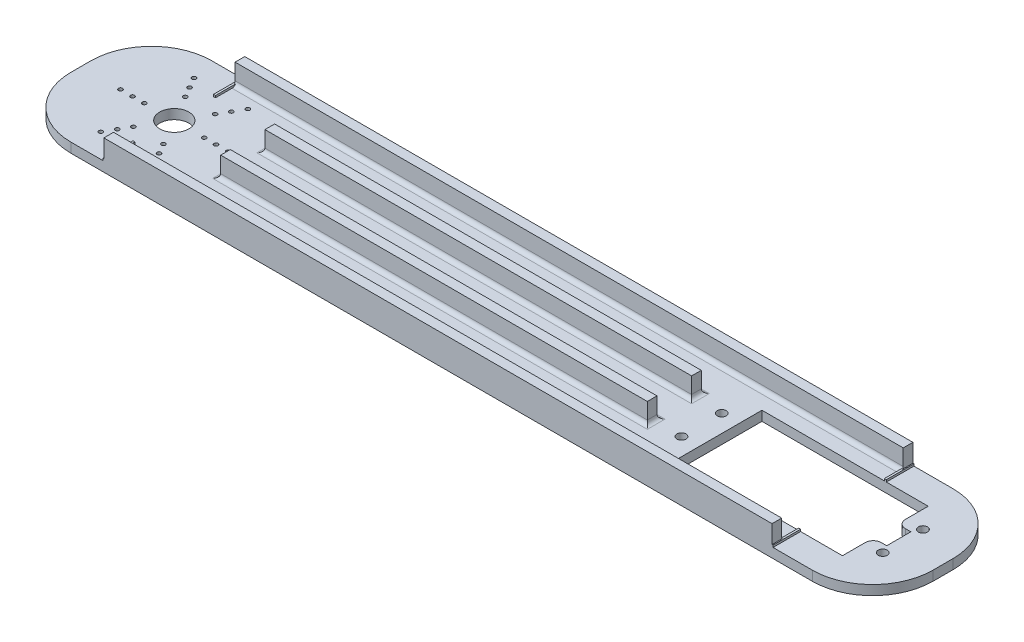
from build123d import *

# Parameters (mm, degrees)
SKETCH1_W               = 214.2
SKETCH1_H               = 35
BOSS_EXTRUDE1_DEPTH     = 2.4
SKETCH2_R               = 1.13
SKETCH2_R_2             = 3.625
SKETCH2_R_3             = 0.5
SKETCH2_W               = 40
SKETCH2_H               = 20
CUT_EXTRUDE1_DEPTH      = 2.4
SKETCH4_W               = 4
SKETCH4_H               = 6
CUT_EXTRUDE2_DEPTH      = 2.4
SKETCH5_W               = 0.5
SKETCH5_H               = 7.5
BOSS_EXTRUDE2_DEPTH     = 0.5
CUT_EXTRUDE3_DEPTH      = 134.373649476
CUT_EXTRUDE3_DEPTH_BACK = 134.373649476
SKETCH7_W               = 41.3
SKETCH7_H               = 21.3
SKETCH7_W_2             = 40
SKETCH7_H_2             = 20
SKETCH8_W               = 166
SKETCH8_H               = 2.4
SKETCH8_W_2             = 106
BOSS_EXTRUDE3_DEPTH     = 5
FILLET1_R               = 15
FILLET2_R               = 2
FILLET3_R               = 1


with BuildPart() as part:
    # Sketch1 → Boss-Extrude1 (new body)
    with BuildSketch(Plane(origin=(0, 0, 0), x_dir=(1, 0, 0), z_dir=(0, 1, 0))):
        with Locations((20.422946176, 21.495750708)):
            Rectangle(SKETCH1_W, SKETCH1_H)
    extrude(amount=BOSS_EXTRUDE1_DEPTH)

    # Sketch2 → Cut-Extrude1 (cut)
    with BuildSketch(Plane(origin=(0, 2.4, 0), x_dir=(1, 0, 0), z_dir=(0, 1, 0))):
        with Locations(Location((67.522946176, 26.495750708, 0), (0, 0, 270))):
            Circle(SKETCH2_R)
        with Locations(Location((117.522946176, 26.495750708, 0), (0, 0, 270))):
            Circle(SKETCH2_R)
        with Locations(Location((117.522946176, 16.495750708, 0), (0, 0, 90))):
            Circle(SKETCH2_R)
        with Locations(Location((67.522946176, 16.495750708, 0), (0, 0, 90))):
            Circle(SKETCH2_R)
        with Locations(Location((-63.477053824, 21.495750708, 0), (0, 0, 270))):
            Circle(SKETCH2_R_2)
        with Locations(Location((-70.907053824, 21.495750708, 0), (0, 0, 270))):
            Circle(SKETCH2_R_3)
        with Locations(Location((-73.842053824, 21.495750708, 0), (0, 0, 270))):
            Circle(SKETCH2_R_3)
        with Locations(Location((-76.847053824, 21.495750708, 0), (0, 0, 270))):
            Circle(SKETCH2_R_3)
        with Locations(Location((-70.162053824, 33.074510357, 0), (0, 0, 270))):
            Circle(SKETCH2_R_3)
        with Locations(Location((-68.659553824, 30.472104018, 0), (0, 0, 270))):
            Circle(SKETCH2_R_3)
        with Locations(Location((-67.192053824, 27.930319458, 0), (0, 0, 270))):
            Circle(SKETCH2_R_3)
        with Locations(Location((-56.792053824, 33.074510357, 0), (0, 0, 270))):
            Circle(SKETCH2_R_3)
        with Locations(Location((-58.294553824, 30.472104018, 0), (0, 0, 270))):
            Circle(SKETCH2_R_3)
        with Locations(Location((-59.762053824, 27.930319458, 0), (0, 0, 270))):
            Circle(SKETCH2_R_3)
        with Locations(Location((-50.107053824, 21.495750708, 0), (0, 0, 270))):
            Circle(SKETCH2_R_3)
        with Locations(Location((-53.112053824, 21.495750708, 0), (0, 0, 270))):
            Circle(SKETCH2_R_3)
        with Locations(Location((-56.047053824, 21.495750708, 0), (0, 0, 270))):
            Circle(SKETCH2_R_3)
        with Locations(Location((-56.792053824, 9.91699106, 0), (0, 0, 270))):
            Circle(SKETCH2_R_3)
        with Locations(Location((-58.294553824, 12.519397398, 0), (0, 0, 270))):
            Circle(SKETCH2_R_3)
        with Locations(Location((-59.762053824, 15.061181958, 0), (0, 0, 270))):
            Circle(SKETCH2_R_3)
        with Locations(Location((-70.162053824, 9.91699106, 0), (0, 0, 270))):
            Circle(SKETCH2_R_3)
        with Locations(Location((-68.659553824, 12.519397398, 0), (0, 0, 270))):
            Circle(SKETCH2_R_3)
        with Locations(Location((-67.192053824, 15.061181958, 0), (0, 0, 270))):
            Circle(SKETCH2_R_3)
        with Locations((92.522946176, 21.495750708)):
            Rectangle(SKETCH2_W, SKETCH2_H)
    extrude(amount=-CUT_EXTRUDE1_DEPTH, mode=Mode.SUBTRACT)

    # Sketch4 → Cut-Extrude2 (cut)
    with BuildSketch(Plane(origin=(0, 2.4, 0), x_dir=(1, 0, 0), z_dir=(0, 1, 0))):
        with Locations((114.522946176, 21.495750708)):
            Rectangle(SKETCH4_W, SKETCH4_H)
    extrude(amount=-CUT_EXTRUDE2_DEPTH, mode=Mode.SUBTRACT)

    # Sketch5 → Boss-Extrude2 (add)
    with BuildSketch(Plane(origin=(0, 2.4, 0), x_dir=(1, 0, 0), z_dir=(0, 1, 0))):
        with Locations((102.522946176, 35.245750708)):
            Rectangle(SKETCH5_W, SKETCH5_H)
        with Locations((102.522946176, 7.745750708)):
            Rectangle(SKETCH5_W, SKETCH5_H)
        with Locations((-63.477053824, 7.745750708)):
            Rectangle(SKETCH5_W, SKETCH5_H)
        with Locations((-63.477053824, 35.245750708)):
            Rectangle(SKETCH5_W, SKETCH5_H)
    extrude(amount=BOSS_EXTRUDE2_DEPTH)

    # Sketch7 → Cut-Extrude3 (cut, two sides: drawn at the far end of the back side and taken through both)
    with BuildSketch(Plane(origin=(0, 2.4, 0), x_dir=(1, 0, 0), z_dir=(0, 1, 0)).offset(-CUT_EXTRUDE3_DEPTH_BACK)):
        with Locations((92.522946176, 21.495750708)):
            Rectangle(SKETCH7_W, SKETCH7_H)
        with Locations((92.522946176, 21.495750708)):
            Rectangle(SKETCH7_W_2, SKETCH7_H_2, mode=Mode.SUBTRACT)
    extrude(amount=CUT_EXTRUDE3_DEPTH + CUT_EXTRUDE3_DEPTH_BACK, mode=Mode.SUBTRACT)

    # Sketch8 → Boss-Extrude3 (add)
    with BuildSketch(Plane(origin=(0, 2.4, 0), x_dir=(1, 0, 0), z_dir=(0, 1, 0))):
        with Locations((19.522946176, 37.795750708)):
            Rectangle(SKETCH8_W, SKETCH8_H)
        with Locations((7.743410163, 26.995750708)):
            Rectangle(SKETCH8_W_2, SKETCH8_H)
        with Locations((7.743410163, 15.995750708)):
            Rectangle(SKETCH8_W_2, SKETCH8_H)
        with Locations((19.522946176, 5.195750708)):
            Rectangle(SKETCH8_W, SKETCH8_H)
    extrude(amount=BOSS_EXTRUDE3_DEPTH)

    # Fillet1
    fillet1_edges = [part.edges().sort_by_distance(p)[0] for p in [
        (-86.677053824, 1.2, -38.995750708),
        (127.522946176, 1.2, -38.995750708),
        (127.522946176, 1.2, -3.995750708),
        (-86.677053824, 1.2, -3.995750708),
    ]]
    fillet(fillet1_edges, radius=FILLET1_R)

    # Fillet2
    fillet2_edges = [part.edges().sort_by_distance(p)[0] for p in [
        (113.172946176, 1.2, -18.495750708),
        (113.172946176, 1.2, -24.495750708),
    ]]
    fillet(fillet2_edges, radius=FILLET2_R)

    # Fillet3
    fillet3_edges = [part.edges().sort_by_distance(p)[0] for p in [
        (19.522946176, 2.4, -6.395750708),
        (60.743410163, 2.4, -15.995750708),
        (7.743410163, 2.4, -17.195750708),
        (60.743410163, 2.4, -26.995750708),
        (7.743410163, 2.4, -28.195750708),
        (7.743410163, 2.4, -14.795750708),
        (-45.256589837, 2.4, -15.995750708),
        (-45.256589837, 2.4, -26.995750708),
        (7.743410163, 2.4, -25.795750708),
        (19.522946176, 2.4, -36.595750708),
    ]]
    fillet(fillet3_edges, radius=FILLET3_R)


solid = part.part
